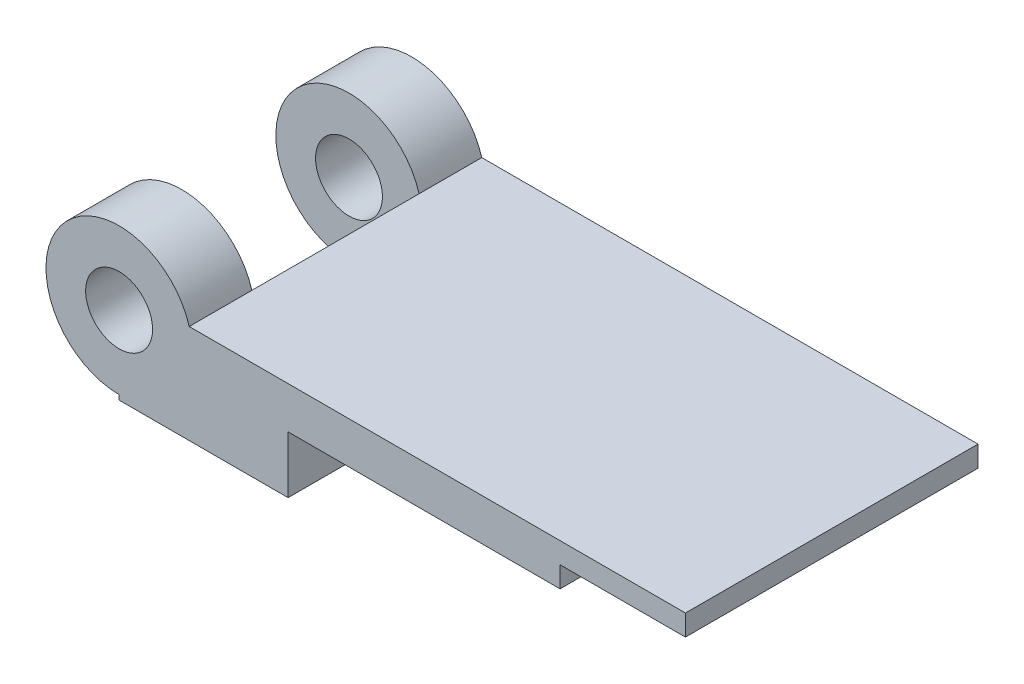
from build123d import *

# Parameters (mm, degrees)
SKETCH_1_R          = 1.6
EXTRUDE_1_DEPTH     = 14
SKETCH_2_W          = 6
SKETCH_2_H          = 1
CUT_EXTRUDE_1_DEPTH = 14
SKETCH_3_R          = 3.5
SKETCH_3_R_2        = 1.6
CUT_EXTRUDE_2_DEPTH = 4
EXTRUDE_2_REACH     = 32.703
SKETCH_9_W          = 7.421187745
SKETCH_9_H          = 1.2
CUT_EXTRUDE_4_DEPTH = 8


with BuildPart() as part:
    # 草图1 → 凸台-拉伸1 (new body)
    with BuildSketch(Plane.XY):
        with BuildLine():
            Line((3.354101966, 1), (27.1, 1))
            Line((27.1, 1), (27.1, -1))
            Line((27.1, -1), (3.354101966, -1))
            ThreePointArc((3.354101966, -1), (-3.5, 0), (3.354101966, 1))
        make_face()
        Circle(SKETCH_1_R, mode=Mode.SUBTRACT)
    extrude(amount=EXTRUDE_1_DEPTH)

    # 草图2 → 切除-拉伸1 (cut)
    with BuildSketch(Plane.XY.offset(14)):
        with Locations((24.1, -0.5)):
            Rectangle(SKETCH_2_W, SKETCH_2_H)
    extrude(amount=-CUT_EXTRUDE_1_DEPTH, mode=Mode.SUBTRACT)

    # 草图3 → 切除-拉伸2 (cut, symmetric)
    with BuildSketch(Plane.XY.offset(7)):
        Circle(SKETCH_3_R)
        Circle(SKETCH_3_R_2, mode=Mode.SUBTRACT)
    extrude(amount=CUT_EXTRUDE_2_DEPTH, both=True, mode=Mode.SUBTRACT)

    # 凸台-拉伸2: up to this face of the body (flat: up to its plane)
    extrude_2_end = Plane(part.part.faces().sort_by_distance((8.055556707, 0.041818565, 0))[0])
    # 草图6 → 凸台-拉伸2 (add, up to the picked face)
    with BuildSketch(Plane.XY.offset(14), mode=Mode.PRIVATE) as extrude_2_sk1:
        with BuildLine():
            Line((8.085544375, -2.1), (8.085544375, -3.4))
            Line((8.085544375, -3.4), (8.085544375, -3.5))
            Line((8.085544375, -3.5), (8.085544375, -3.728060251))
            Line((8.085544375, -3.728060251), (0, -3.728060251))
            Line((0, -3.728060251), (0, -3.5))
            ThreePointArc((0, -3.5), (2.091650066, -2.80624304), (3.354101966, -1))
            Line((3.354101966, -1), (8.085544375, -1))
            Line((8.085544375, -1), (8.085544375, -2.1))
        make_face()
    extrude_2_tool1 = split(extrude(extrude_2_sk1.sketch, amount=-EXTRUDE_2_REACH, mode=Mode.PRIVATE), bisect_by=extrude_2_end, keep=Keep.BOTH, mode=Mode.PRIVATE)
    add(extrude_2_tool1.solids().sort_by(Axis((5.088052, -2.490325, 14), (0, 0, -1)))[0])

    # 草图9 → 切除-拉伸4 (cut)
    with BuildSketch(Plane.XY.offset(11)):
        with Locations((4.374950503, -2.75)):
            Rectangle(SKETCH_9_W, SKETCH_9_H)
    extrude(amount=-CUT_EXTRUDE_4_DEPTH, mode=Mode.SUBTRACT)


solid = part.part
